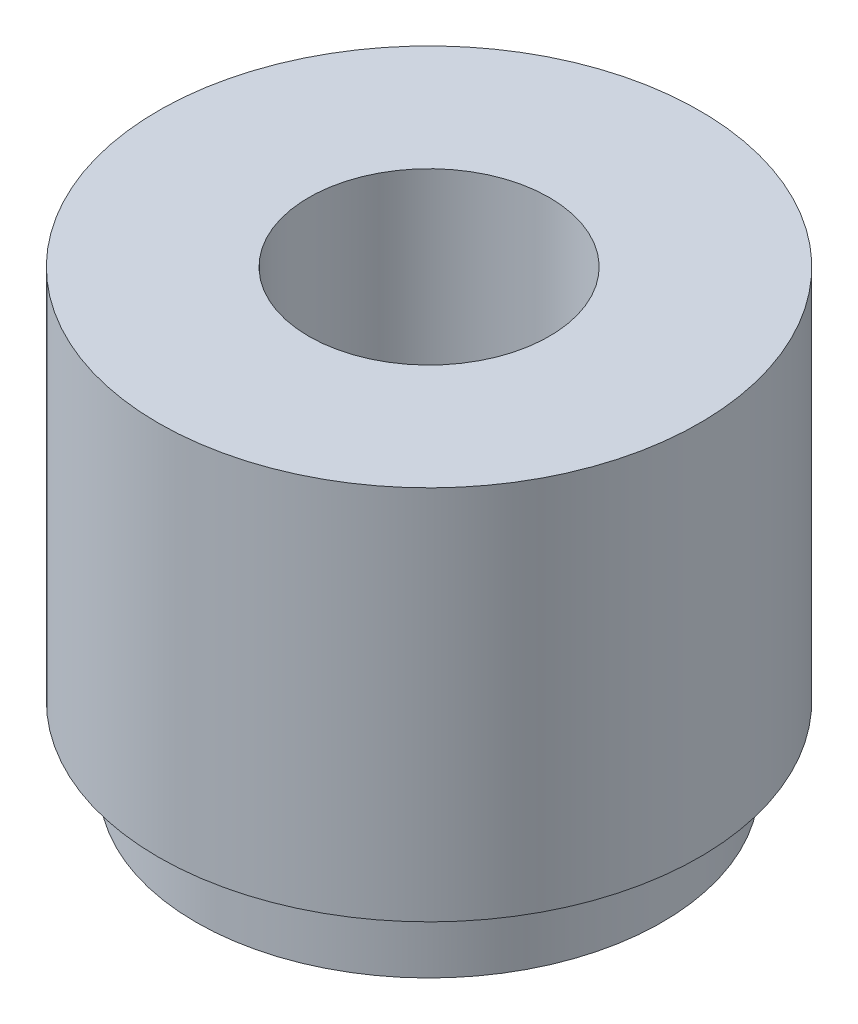
from build123d import *

# Parameters (mm, degrees)
TAP_DRILL_FOR_M2_TAP1_D = 1.6


with BuildPart() as part:
    # Sketch1 → Revolve1 (revolve)
    with BuildSketch(Plane.XY, mode=Mode.PRIVATE) as revolve1_sk:
        Polygon((0, 0), (1.55, 0), (1.55, 0.5), (1.8, 0.5), (1.8, 3), (0, 3), align=None)
    revolve(revolve1_sk.sketch.rotate(Axis((0, 3, 0), (0, -1, 0)), 90), axis=Axis((0, 3, 0), (0, -1, 0)))

    # Tap Drill for M2 Tap1 (through all)
    with Locations(Plane(origin=(0, 3, 0), x_dir=(1, 0, 0), z_dir=(0, 1, 0))):
        with Locations((0, 0)):
            Hole(TAP_DRILL_FOR_M2_TAP1_D / 2)


solid = part.part
